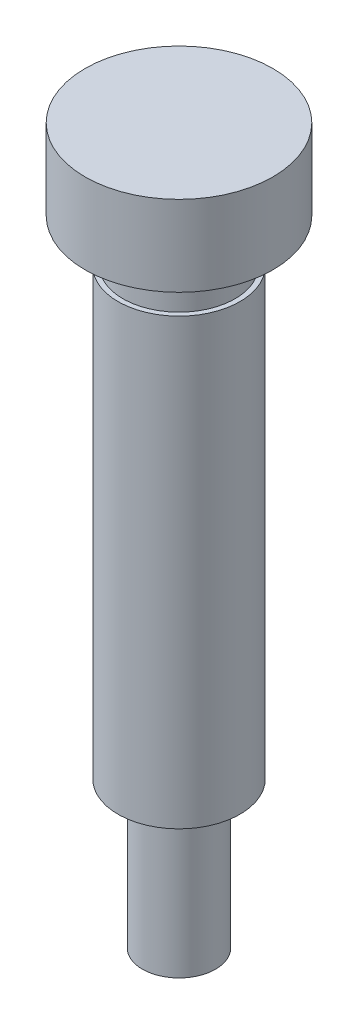
from build123d import *


with BuildPart() as part:
    # Sketch1 → Revolve1 (revolve)
    with BuildSketch(Plane.XY, mode=Mode.PRIVATE) as revolve1_sk:
        Polygon((0, 0), (1.5, 0), (1.5, 6), (2.5, 6), (2.5, 24.2), (2.3, 24.2), (2.3, 26), (3.85, 26), (3.85, 29.3), (0, 29.3), align=None)
    revolve(revolve1_sk.sketch.rotate(Axis((0, 29.3, 0), (0, -1, 0)), 180), axis=Axis((0, 29.3, 0), (0, -1, 0)))


solid = part.part
